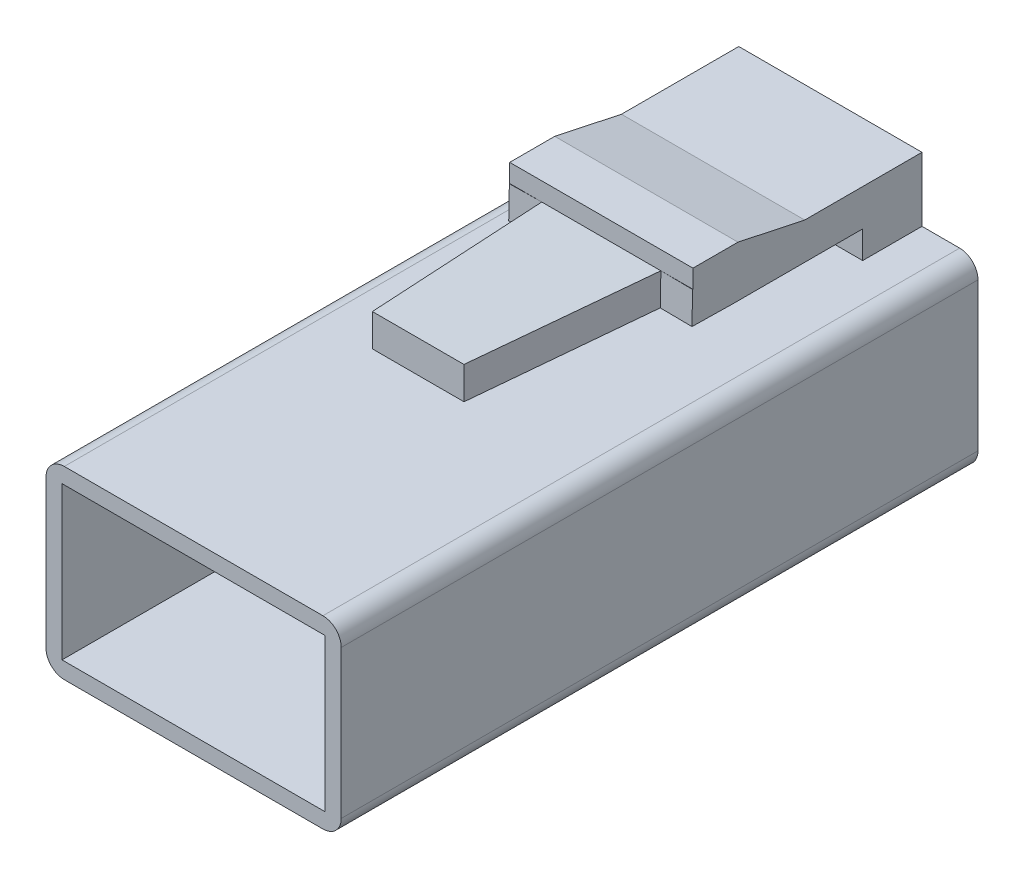
from build123d import *

# Parameters (mm, degrees)
BOSS_EXTRUDE1_DEPTH      = 10
BOSS_EXTRUDE1_DEPTH_BACK = 3.9
SKETCH2_W                = 6.445
SKETCH2_H                = 4.032
SKETCH2_W_2              = 4.545
SKETCH2_H_2              = 2.132
SKETCH3_W                = 5.745
SKETCH3_H                = 3.332
CUT_EXTRUDE1_DEPTH       = 10
FILLET1_R                = 0.4
BOSS_EXTRUDE2_DEPTH      = 2
BOSS_EXTRUDE2_DEPTH_BACK = 2
CUT_EXTRUDE2_REACH       = 13.831


with BuildPart() as part:
    # Sketch2 → Boss-Extrude1 (new, two sides: drawn at the far end of the back side and taken through both)
    with BuildSketch(Plane.XY.offset(-BOSS_EXTRUDE1_DEPTH_BACK)):
        Rectangle(SKETCH2_W, SKETCH2_H)
        Rectangle(SKETCH2_W_2, SKETCH2_H_2, mode=Mode.SUBTRACT)
    extrude(amount=BOSS_EXTRUDE1_DEPTH + BOSS_EXTRUDE1_DEPTH_BACK)

    # Sketch3 → Cut-Extrude1 (cut)
    with BuildSketch(Plane.XY):
        Rectangle(SKETCH3_W, SKETCH3_H)
    extrude(amount=CUT_EXTRUDE1_DEPTH, mode=Mode.SUBTRACT)

    # Fillet1
    fillet1_edges = [part.edges().sort_by_distance(p)[0] for p in [
        (-3.2225, 2.016, 3.05),
        (3.2225, 2.016, 3.05),
        (3.2225, -2.016, 3.05),
        (-3.2225, -2.016, 3.05),
    ]]
    fillet(fillet1_edges, radius=FILLET1_R)

    # Sketch6 → Boss-Extrude2 (add, two sides: drawn at the far end of the back side and taken through both)
    with BuildSketch(Plane(origin=(0, 0, 0), x_dir=(0, 0, -1), z_dir=(1, 0, 0)).offset(-BOSS_EXTRUDE2_DEPTH_BACK)):
        Polygon((3.9, 2.016), (3.9001, 3.416), (1.339853874, 3.416), (-0.11724349, 3.726), (-1.1, 3.726), (-1.1, 3.326), (-5.098455185, 3.40488658), (-5.098455185, 2.699069635), (-0.216775103, 2.616), (2.605304601, 2.616), (2.605304601, 2.016), align=None)
    extrude(amount=BOSS_EXTRUDE2_DEPTH + BOSS_EXTRUDE2_DEPTH_BACK)

    # Cut-Extrude2: up to this plane
    cut_extrude2_end = Plane(origin=(-2, 2.699069635, 5.098455185), z_dir=(0, -0.9998552489648911, 0.017014144626037273))
    # Sketch7 → Cut-Extrude2 (cut, up to the surface)
    with BuildSketch(Plane(origin=(0, 3.303012132, -0.065166), x_dir=(1, 0, 0), z_dir=(0, 0.9998054348584555, -0.019725425914151256)), mode=Mode.PRIVATE) as cut_extrude2_sk1:
        Polygon((-1, -5.164626041), (-1.3, -1.165392745), (-2, -1.173282915), (-2, -5.164626041), align=None)
    cut_extrude2_tool1 = split(extrude(cut_extrude2_sk1.sketch, amount=-CUT_EXTRUDE2_REACH, mode=Mode.PRIVATE), bisect_by=cut_extrude2_end, keep=Keep.BOTH, mode=Mode.PRIVATE)
    add(cut_extrude2_tool1.solids().sort_by_distance((-1.570429, 3.367797, 3.218548))[0], mode=Mode.SUBTRACT)
    # Sketch7 → Cut-Extrude2 (cut, up to the surface)
    with BuildSketch(Plane(origin=(0, 3.303012132, -0.065166), x_dir=(1, 0, 0), z_dir=(0, 0.9998054348584555, -0.019725425914151256)), mode=Mode.PRIVATE) as cut_extrude2_sk2:
        Polygon((1, -5.164626041), (1.3, -1.165392745), (2, -1.173282915), (2, -5.164626041), align=None)
    cut_extrude2_tool2 = split(extrude(cut_extrude2_sk2.sketch, amount=-CUT_EXTRUDE2_REACH, mode=Mode.PRIVATE), bisect_by=cut_extrude2_end, keep=Keep.BOTH, mode=Mode.PRIVATE)
    add(cut_extrude2_tool2.solids().sort_by_distance((1.570429, 3.367797, 3.218548))[0], mode=Mode.SUBTRACT)


solid = part.part
